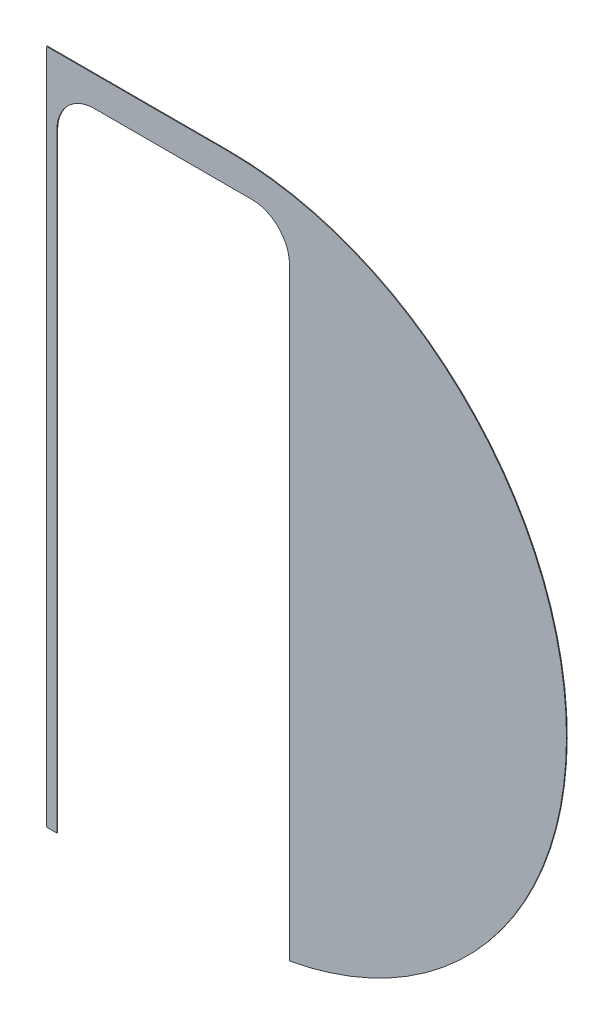
from build123d import *

# Parameters (mm, degrees)
BOSS_EXTRUDE1_DEPTH = 2
CUT_EXTRUDE3_DEPTH  = 330


with BuildPart() as part:
    # Sketch1 → Boss-Extrude1 (new body)
    with BuildSketch(Plane.XY):
        with BuildLine():
            Line((0, 0), (485, 0))
            ThreePointArc((485, 0), (1387.5, 902.5), (485, 1805))
            Line((485, 1805), (0, 1805))
            Line((0, 1805), (0, 0))
        make_face()
    extrude(amount=BOSS_EXTRUDE1_DEPTH)

    # Sketch4 → Cut-Extrude3 (cut)
    with BuildSketch(Plane(origin=(-1339.112118138, -944.457487155, 0), x_dir=(-1, 0, 0), z_dir=(0, 0, -1))):
        with BuildLine():
            Line((-1887.112118138, 819.457487155), (-1466.112118138, 819.457487155))
            ThreePointArc((-1466.112118138, 819.457487155), (-1395.40144002, 848.746809036), (-1366.112118138, 919.457487155))
            Line((-1366.112118138, 919.457487155), (-1366.112118138, 2569.457487155))
            ThreePointArc((-1366.112118138, 2569.457487155), (-1395.40144002, 2640.168165273), (-1466.112118138, 2669.457487155))
            Line((-1466.112118138, 2669.457487155), (-1887.112118138, 2669.457487155))
            ThreePointArc((-1887.112118138, 2669.457487155), (-1957.822796257, 2640.168165273), (-1987.112118138, 2569.457487155))
            Line((-1987.112118138, 2569.457487155), (-1987.112118138, 919.457487155))
            ThreePointArc((-1987.112118138, 919.457487155), (-1957.822796257, 848.746809036), (-1887.112118138, 819.457487155))
        make_face()
    extrude(amount=-CUT_EXTRUDE3_DEPTH, mode=Mode.SUBTRACT)


solid = part.part
